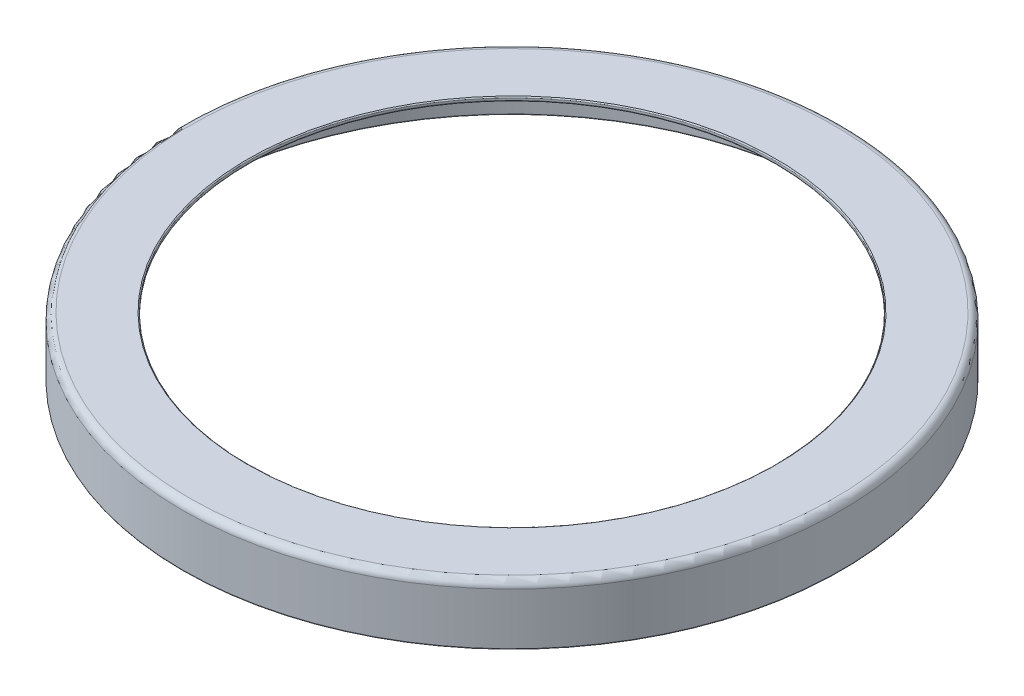
from build123d import *

# Parameters (mm, degrees)
FILETE1_R = 1.75
FILETE2_R = 0.5
FILETE4_R = 0.25


with BuildPart() as part:
    # Esboço1 → Revolução1 (revolve)
    with BuildSketch(Plane.XY, mode=Mode.PRIVATE) as revolu_o1_sk:
        Polygon((65.15, 28.571483942), (65.15, 29.571483942), (81.5, 29.571483942), (81.5, 14.821483942), (80.5, 14.821483942), (80.5, 28.571483942), align=None)
    revolve(revolu_o1_sk.sketch.rotate(Axis((0, -73.042580288, 0), (0, 1, 0)), 90), axis=Axis((0, -73.042580288, 0), (0, 1, 0)))

    # Filete1
    filete1_edges = [part.edges().sort_by_distance(p)[0] for p in [
        (0, 29.571483942, 81.5),
    ]]
    fillet(filete1_edges, radius=FILETE1_R)

    # Filete2
    filete2_edges = [part.edges().sort_by_distance(p)[0] for p in [
        (0, 28.571483942, 80.5),
    ]]
    fillet(filete2_edges, radius=FILETE2_R)

    # Filete4
    filete4_edges = [part.edges().sort_by_distance(p)[0] for p in [
        (0, 14.821483942, 80.5),
        (0, 14.821483942, 81.5),
        (0, 29.571483942, 65.15),
        (0, 28.571483942, 65.15),
    ]]
    fillet(filete4_edges, radius=FILETE4_R)


solid = part.part
